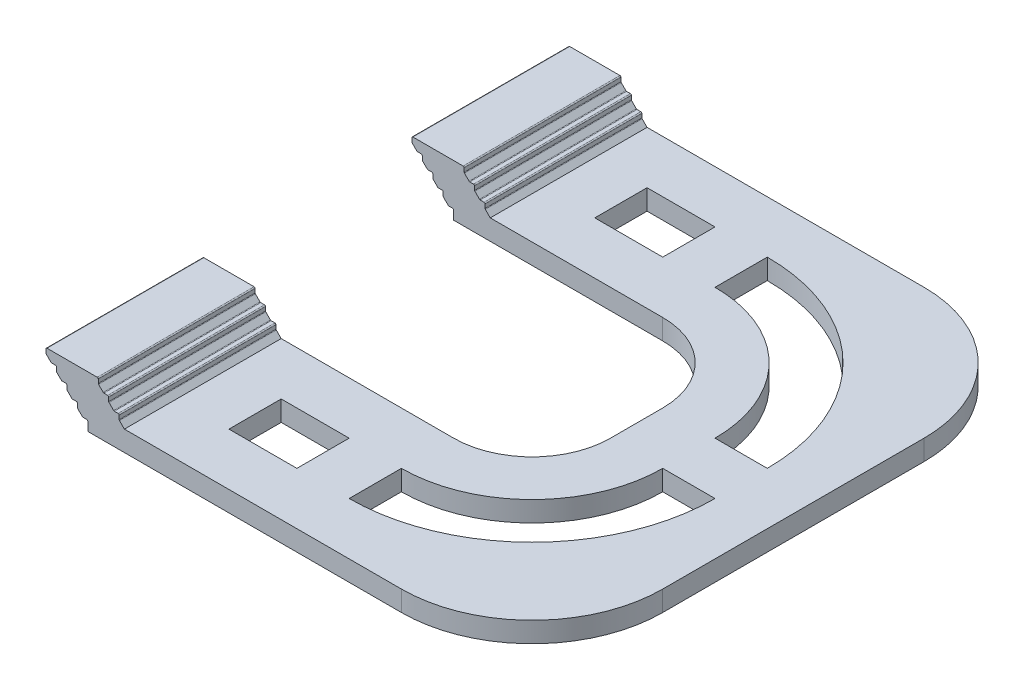
from build123d import *

# Parameters (mm, degrees)
BOSS_EXTRUDE1_DEPTH     = 100
CUT_EXTRUDE1_DEPTH      = 24
CUT_EXTRUDE1_DEPTH_BACK = 24
FILLET2_R               = 25
SKETCH4_W               = 13
SKETCH4_H               = 10
CUT_EXTRUDE3_DEPTH      = 23


with BuildPart() as part:
    # Sketch1 → Boss-Extrude1 (new body)
    with BuildSketch(Plane.XY):
        with BuildLine():
            Line((-25.742274507, -27.495485701), (-25.742274507, -25.803839777))
            ThreePointArc((-25.742274507, -25.803839777), (-25.800853151, -25.66241842), (-25.942274507, -25.603839777))
            Line((-25.942274507, -25.603839777), (-26.659431795, -25.603839777))
            ThreePointArc((-26.659431795, -25.603839777), (-26.735968481, -25.588615683), (-26.800853151, -25.545261133))
            Line((-26.800853151, -25.545261133), (-27.683698081, -24.662416203))
            ThreePointArc((-27.683698081, -24.662416203), (-27.72705275, -24.597531247), (-27.742276725, -24.520994228))
            Line((-27.742276725, -24.520994228), (-27.742274507, -23.803840395))
            ThreePointArc((-27.742274507, -23.803840395), (-27.800852932, -23.662418639), (-27.942274507, -23.603839777))
            Line((-27.942274507, -23.603839777), (-28.659430376, -23.603840885))
            ThreePointArc((-28.659430376, -23.603840885), (-28.735967229, -23.588616851), (-28.800852042, -23.545262242))
            Line((-28.800852042, -23.545262242), (-29.683696972, -22.662417311))
            ThreePointArc((-29.683696972, -22.662417311), (-29.727051582, -22.597532499), (-29.742275616, -22.520995646))
            Line((-29.742275616, -22.520995646), (-29.742274507, -21.803839777))
            ThreePointArc((-29.742274507, -21.803839777), (-29.800853256, -21.662418316), (-29.942274803, -21.603839777))
            Line((-29.942274803, -21.603839777), (-30.659430376, -21.603840885))
            ThreePointArc((-30.659430376, -21.603840885), (-30.735967229, -21.588616851), (-30.800852042, -21.545262242))
            Line((-30.800852042, -21.545262242), (-31.683696972, -20.662417311))
            ThreePointArc((-31.683696972, -20.662417311), (-31.727051582, -20.597532499), (-31.742275616, -20.520995646))
            Line((-31.742275616, -20.520995646), (-31.742274507, -19.80383981))
            ThreePointArc((-31.742274507, -19.80383981), (-31.800854095, -19.662417476), (-31.942277212, -19.603839777))
            Line((-31.942277212, -19.603839777), (-32.659432785, -19.603840885))
            ThreePointArc((-32.659432785, -19.603840885), (-32.735969638, -19.588616851), (-32.80085445, -19.545262242))
            Line((-32.80085445, -19.545262242), (-33.683699381, -18.662417311))
            ThreePointArc((-33.683699381, -18.662417311), (-33.727054119, -18.597532189), (-33.742278024, -18.520994974))
            Line((-33.742278024, -18.520994974), (-33.742274507, -17.803842952))
            ThreePointArc((-33.742274507, -17.803842952), (-33.683696986, -17.662419543), (-33.542274507, -17.603839777))
            Line((-33.542274507, -17.603839777), (-23.942274507, -17.603839777))
            ThreePointArc((-23.942274507, -17.603839777), (-23.800853151, -17.66241842), (-23.742274507, -17.803839777))
            Line((-23.742274507, -17.803839777), (-23.742274507, -18.520997064))
            ThreePointArc((-23.742274507, -18.520997064), (-23.727050414, -18.597533751), (-23.683695863, -18.66241842))
            Line((-23.683695863, -18.66241842), (-22.800853151, -19.545261133))
            ThreePointArc((-22.800853151, -19.545261133), (-22.735968481, -19.588615683), (-22.659431795, -19.603839777))
            Line((-22.659431795, -19.603839777), (-21.942274507, -19.603839777))
            ThreePointArc((-21.942274507, -19.603839777), (-21.800853151, -19.66241842), (-21.742274507, -19.803839777))
            Line((-21.742274507, -19.803839777), (-21.742274507, -20.520997064))
            ThreePointArc((-21.742274507, -20.520997064), (-21.727050414, -20.597533751), (-21.683695863, -20.66241842))
            Line((-21.683695863, -20.66241842), (-20.800853151, -21.545261133))
            ThreePointArc((-20.800853151, -21.545261133), (-20.735968481, -21.588615683), (-20.659431795, -21.603839777))
            Line((-20.659431795, -21.603839777), (-19.942274507, -21.603839777))
            ThreePointArc((-19.942274507, -21.603839777), (-19.800853151, -21.66241842), (-19.742274507, -21.803839777))
            Line((-19.742274507, -21.803839777), (-19.742274507, -22.520997064))
            ThreePointArc((-19.742274507, -22.520997064), (-19.727050414, -22.597533751), (-19.683695863, -22.66241842))
            Line((-19.683695863, -22.66241842), (-18.742274507, -23.603839777))
            Line((-18.742274507, -23.603839777), (-17.742274507, -23.603839777))
            Line((-17.742274507, -23.603839777), (59.257725493, -23.603839777))
            Line((59.257725493, -23.603839777), (59.257725493, -27.495485701))
            Line((59.257725493, -27.495485701), (-25.742274507, -27.495485701))
        make_face()
    extrude(amount=BOSS_EXTRUDE1_DEPTH)

    # Sketch2 → Cut-Extrude1 (cut, two sides: drawn at the far end of the back side and taken through both)
    with BuildSketch(Plane(origin=(0, -23.603839777, 0), x_dir=(1, 0, 0), z_dir=(0, 1, 0)).offset(-CUT_EXTRUDE1_DEPTH_BACK)):
        with BuildLine():
            Line((14.257725493, -30), (-42.622702361, -30))
            Line((-42.622702361, -30), (-42.622702361, -70))
            Line((-42.622702361, -70), (14.257725493, -70))
            ThreePointArc((14.257725493, -70), (24.864327211, -65.606601718), (29.257725493, -55))
            Line((29.257725493, -55), (29.257725493, -45))
            ThreePointArc((29.257725493, -45), (24.864327211, -34.393398282), (14.257725493, -30))
        make_face()
    extrude(amount=CUT_EXTRUDE1_DEPTH + CUT_EXTRUDE1_DEPTH_BACK, mode=Mode.SUBTRACT)

    # Fillet2
    fillet2_edges = [part.edges().sort_by_distance(p)[0] for p in [
        (59.257725493, -25.549662739, 100),
        (59.257725493, -25.549662739, 0),
    ]]
    fillet(fillet2_edges, radius=FILLET2_R)

    # Sketch4 → Cut-Extrude3 (cut)
    with BuildSketch(Plane(origin=(0, -23.603839777, 0), x_dir=(1, 0, 0), z_dir=(0, 1, 0))):
        with BuildLine():
            Line((14.257725493, -90), (14.257725493, -80))
            ThreePointArc((14.257725493, -80), (31.935395023, -72.67766953), (39.257725493, -55))
            Line((39.257725493, -55), (49.257725493, -55))
            ThreePointArc((49.257725493, -55), (39.006462834, -79.748737342), (14.257725493, -90))
        make_face()
        with Locations((-2.242274507, -85)):
            Rectangle(SKETCH4_W, SKETCH4_H)
        with BuildLine():
            Line((14.257725493, -20), (14.257725493, -10))
            ThreePointArc((14.257725493, -10), (39.006462834, -20.251262658), (49.257725493, -45))
            Line((49.257725493, -45), (39.257725493, -45))
            ThreePointArc((39.257725493, -45), (31.935395023, -27.32233047), (14.257725493, -20))
        make_face()
        with Locations((-2.242274507, -15)):
            Rectangle(SKETCH4_W, SKETCH4_H)
    extrude(amount=-CUT_EXTRUDE3_DEPTH, mode=Mode.SUBTRACT)


solid = part.part
